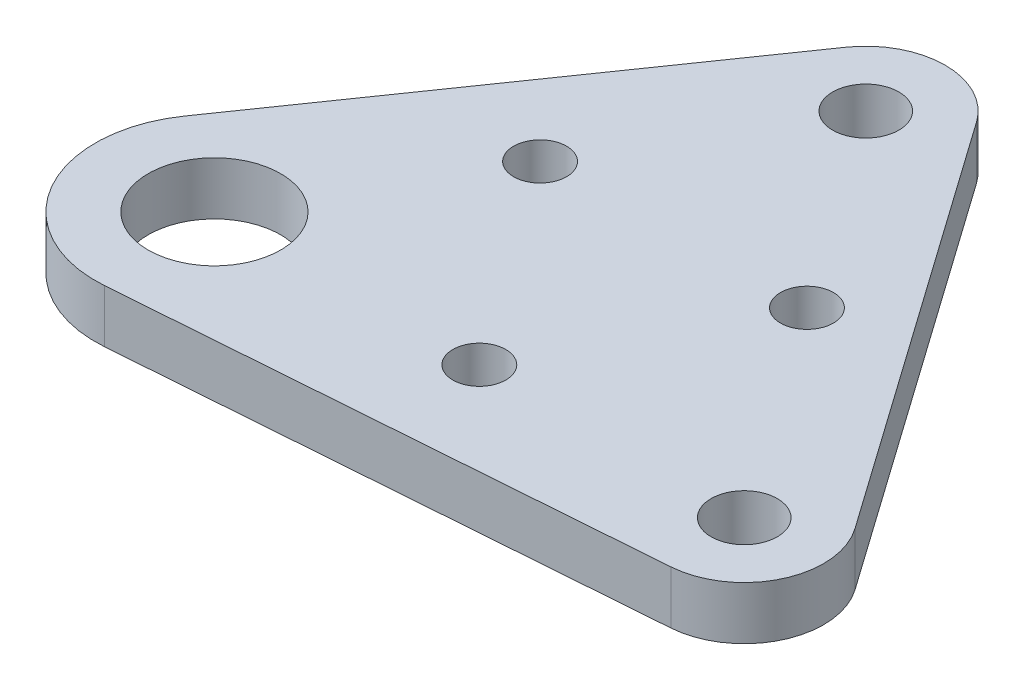
from build123d import *

# Parameters (mm, degrees)
SKETCH1_R           = 3.96875
SKETCH1_R_2         = 7.9375
SKETCH1_R_3         = 3.175
BOSS_EXTRUDE1_DEPTH = 6.35


with BuildPart() as part:
    # Sketch1 → Boss-Extrude1 (new body)
    with BuildSketch(Plane(origin=(0, 0, 0), x_dir=(1, 0, 0), z_dir=(0, 1, 0))):
        with BuildLine():
            Line((1.0715625, -14.247259739), (64.214375, -9.498173159))
            ThreePointArc((64.214375, -9.498173159), (72.11528772, -4.062319842), (71.282469536, 5.491702188))
            Line((71.282469536, 5.491702188), (36.357469536, 54.985054015))
            ThreePointArc((36.357469536, 54.985054015), (28.539380338, 59.018285224), (20.751674914, 54.926694223))
            Line((20.751674914, 54.926694223), (-11.734987629, 8.150013595))
            ThreePointArc((-11.734987629, 8.150013595), (-12.403089215, -7.091969697), (1.0715625, -14.247259739))
        make_face()
        with Locations(Location((28.575, 49.493351826, 0), (0, 0, 270))):
            Circle(SKETCH1_R, mode=Mode.SUBTRACT)
        with Locations(Location((0, 0, 0), (0, 0, 270))):
            Circle(SKETCH1_R_2, mode=Mode.SUBTRACT)
        with Locations(Location((63.5, 0, 0), (0, 0, 270))):
            Circle(SKETCH1_R, mode=Mode.SUBTRACT)
        with Locations(Location((14.2875, 24.746675913, 0), (0, 0, 270))):
            Circle(SKETCH1_R_3, mode=Mode.SUBTRACT)
        with Locations(Location((31.75, 0, 0), (0, 0, 270))):
            Circle(SKETCH1_R_3, mode=Mode.SUBTRACT)
        with Locations(Location((45.471967279, 25.5481107, 0), (0, 0, 270))):
            Circle(SKETCH1_R_3, mode=Mode.SUBTRACT)
    extrude(amount=BOSS_EXTRUDE1_DEPTH)


solid = part.part
